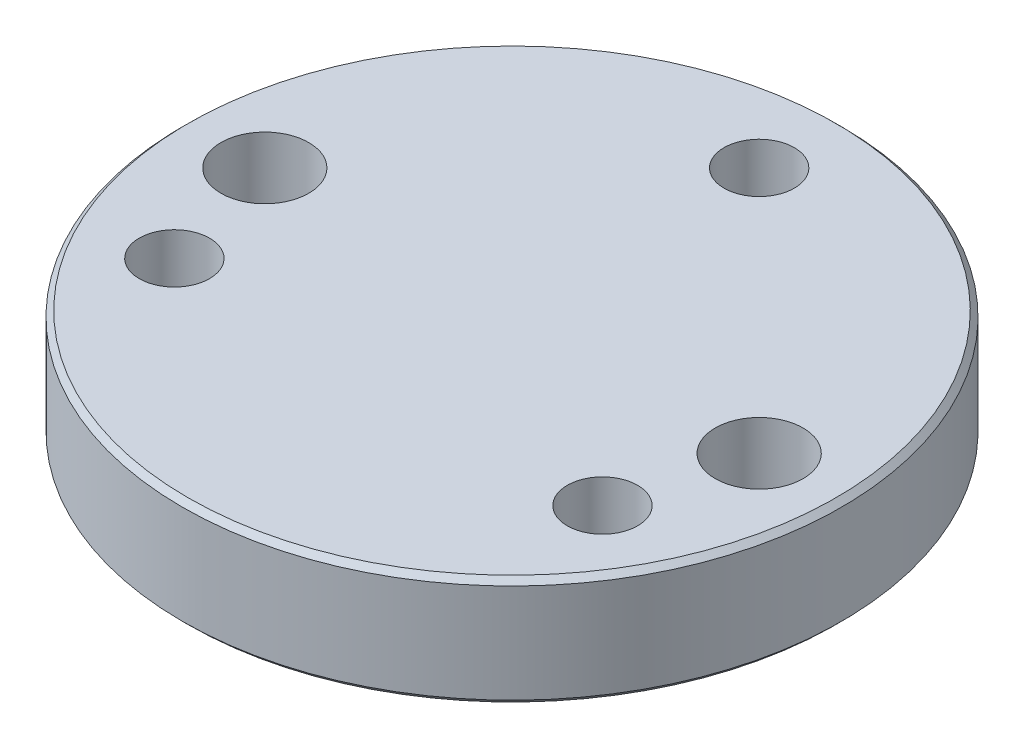
from build123d import *

# Parameters (mm, degrees)
SKETCH1_R             = 30
BOSS_EXTRUDE1_DEPTH   = 10
F_8_0MM_DOWEL_HOLE1_D = 8
M6_CLEARANCE_HOLE1_D  = 6.4
CHAMFER1_SIZE         = 0.5


with BuildPart() as part:
    # Sketch1 → Boss-Extrude1 (new body)
    with BuildSketch(Plane(origin=(0, 0, 0), x_dir=(1, 0, 0), z_dir=(0, 1, 0))):
        with Locations(Location((0, 0, 0), (0, 0, 270))):
            Circle(SKETCH1_R)
    extrude(amount=-BOSS_EXTRUDE1_DEPTH)

    # Ø8.0mm Dowel Hole1 (through all)
    with Locations(Plane(origin=(0, 0, 0), x_dir=(1, 0, 0), z_dir=(0, 1, 0))):
        with Locations((-22.5, 0), (22.5, 0)):
            Hole(F_8_0MM_DOWEL_HOLE1_D / 2)

    # M6 Clearance Hole1 (through all)
    with Locations(Plane(origin=(0, 0, 0), x_dir=(1, 0, 0), z_dir=(0, 1, 0))):
        with Locations((19.485571585, -11.25), (-19.485571585, -11.25), (0, 22.5)):
            Hole(M6_CLEARANCE_HOLE1_D / 2)

    # Chamfer1
    chamfer1_edges = [part.edges().sort_by_distance(p)[0] for p in [
        (0, 0, -30),
        (0, -10, -30),
    ]]
    chamfer(chamfer1_edges, length=CHAMFER1_SIZE)


solid = part.part
